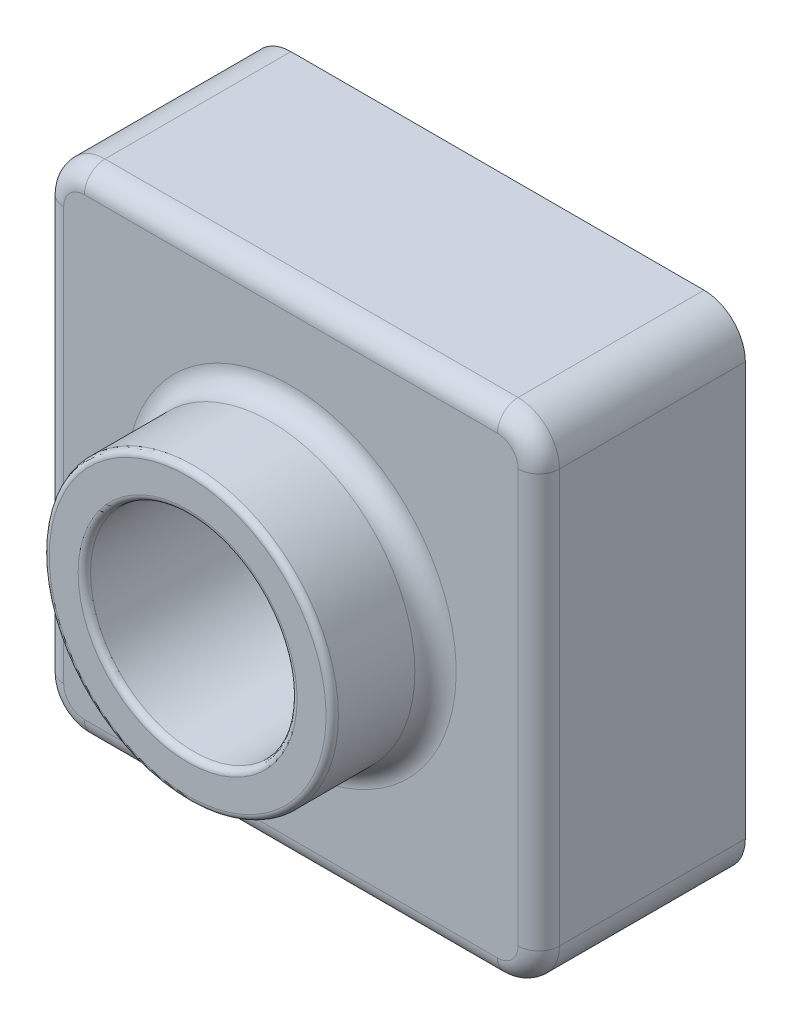
from build123d import *

# Parameters (mm, degrees)
SKETCH1_W              = 120
SKETCH1_H              = 120.00000003
BOX_DEPTH              = 50
SKETCH2_R              = 35
CYLINDRICAL_PART_DEPTH = 25
SKETCH3_R              = 25
CUT_EXTRUDE1_DEPTH     = 186.539753172
FILLET1_R              = 10
FILLET2_R              = 1.5
FILLET3_R              = 5
SHELL1_T               = -2
BODY_MOVE_COPY1_ANGLE  = 180


with BuildPart() as part:
    # Sketch1 → box (new body)
    with BuildSketch(Plane.XY):
        with Locations((60, 60.000000015)):
            Rectangle(SKETCH1_W, SKETCH1_H)
    extrude(amount=BOX_DEPTH)

    # Sketch2 → cylindrical part (add)
    with BuildSketch(Plane(origin=(0, 0, 0), x_dir=(-1, 0, 0), z_dir=(0, 0, -1))):
        with Locations((-60, 60.00000003)):
            Circle(SKETCH2_R)
    extrude(amount=CYLINDRICAL_PART_DEPTH)

    # Sketch3 → Cut-Extrude1 (cut, through all)
    with BuildSketch(Plane(origin=(0, 0, -25), x_dir=(-1, 0, 0), z_dir=(0, 0, -1))):
        with Locations((-60, 60.00000003)):
            Circle(SKETCH3_R)
    extrude(amount=-CUT_EXTRUDE1_DEPTH, mode=Mode.SUBTRACT)

    # Fillet1
    fillet1_edges = [part.edges().sort_by_distance(p)[0] for p in [
        (0, 120.00000003, 25),
        (120, 120.00000003, 25),
        (120, 0, 25),
        (0, 0, 25),
    ]]
    fillet(fillet1_edges, radius=FILLET1_R)

    # Fillet2
    fillet2_edges = [part.edges().sort_by_distance(p)[0] for p in [
        (95, 60.00000003, -25),
        (85, 60.00000003, -25),
    ]]
    fillet(fillet2_edges, radius=FILLET2_R)

    # Fillet3
    fillet3_edges = [part.edges().sort_by_distance(p)[0] for p in [
        (95, 60.00000003, 0),
        (60, 0, 0),
        (0, 60.000000015, 0),
        (60, 120.00000003, 0),
        (120, 60.000000015, 0),
        (2.928932188, 117.071067842, 0),
        (117.071067812, 117.071067842, 0),
        (117.071067812, 2.928932188, 0),
        (2.928932188, 2.928932188, 0),
    ]]
    fillet(fillet3_edges, radius=FILLET3_R)

    # Shell1
    shell1_openings = [part.faces().sort_by_distance(p)[0] for p in [
        (60, 1.697056275, 50),
    ]]
    offset(amount=SHELL1_T, openings=shell1_openings, kind=Kind.INTERSECTION)


with BuildPart() as part_1:
    # Body-Move/Copy1: moved
    add(part.part.rotate(Axis((0, 60.000000015, 12.5), (1, 0, 0)), BODY_MOVE_COPY1_ANGLE))


solid = part_1.part
